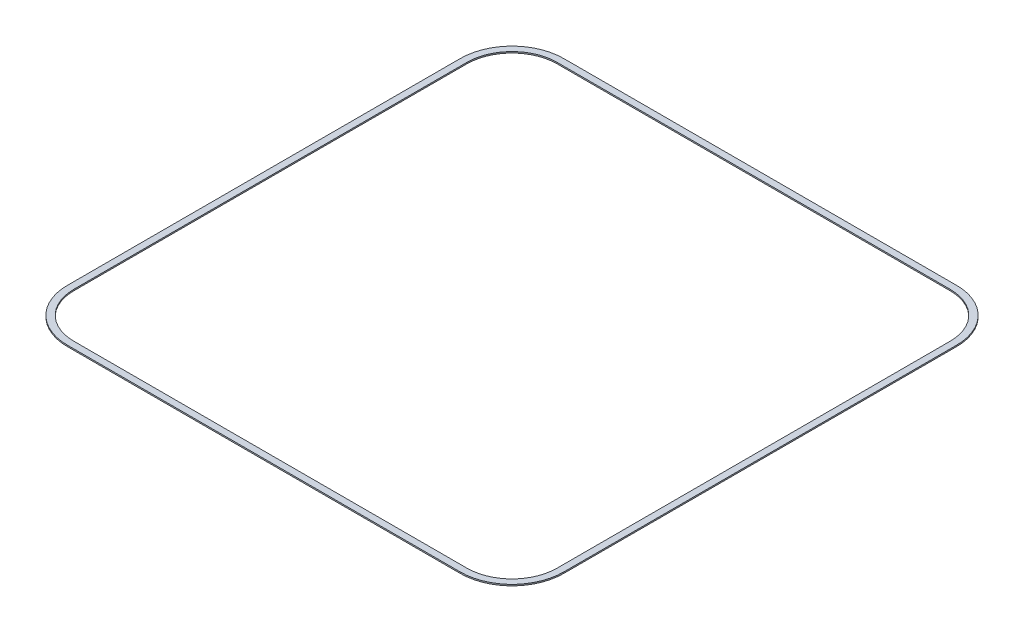
from build123d import *

# Parameters (mm, degrees)
BOSS_EXTRUDE1_DEPTH = 1


with BuildPart() as part:
    # Sketch1 → Boss-Extrude1 (new body)
    with BuildSketch(Plane(origin=(0, 0, 0), x_dir=(1, 0, 0), z_dir=(0, 1, 0))):
        with BuildLine():
            Line((187.5, 148.5), (187.5, -148.5))
            ThreePointArc((187.5, -148.5), (176.077164466, -176.077164466), (148.5, -187.5))
            Line((148.5, -187.5), (-148.5, -187.5))
            ThreePointArc((-148.5, -187.5), (-176.077164466, -176.077164466), (-187.5, -148.5))
            Line((-187.5, -148.5), (-187.5, 148.5))
            ThreePointArc((-187.5, 148.5), (-176.077164466, 176.077164466), (-148.5, 187.5))
            Line((-148.5, 187.5), (148.5, 187.5))
            ThreePointArc((148.5, 187.5), (176.077164466, 176.077164466), (187.5, 148.5))
        make_face()
        with BuildLine():
            Line((-148.5, 182.5), (148.5, 182.5))
            ThreePointArc((148.5, 182.5), (172.54163056, 172.54163056), (182.5, 148.5))
            Line((182.5, 148.5), (182.5, -148.5))
            ThreePointArc((182.5, -148.5), (172.54163056, -172.54163056), (148.5, -182.5))
            Line((148.5, -182.5), (-148.5, -182.5))
            ThreePointArc((-148.5, -182.5), (-172.54163056, -172.54163056), (-182.5, -148.5))
            Line((-182.5, -148.5), (-182.5, 148.5))
            ThreePointArc((-182.5, 148.5), (-172.54163056, 172.54163056), (-148.5, 182.5))
        make_face(mode=Mode.SUBTRACT)
    extrude(amount=BOSS_EXTRUDE1_DEPTH)


solid = part.part
